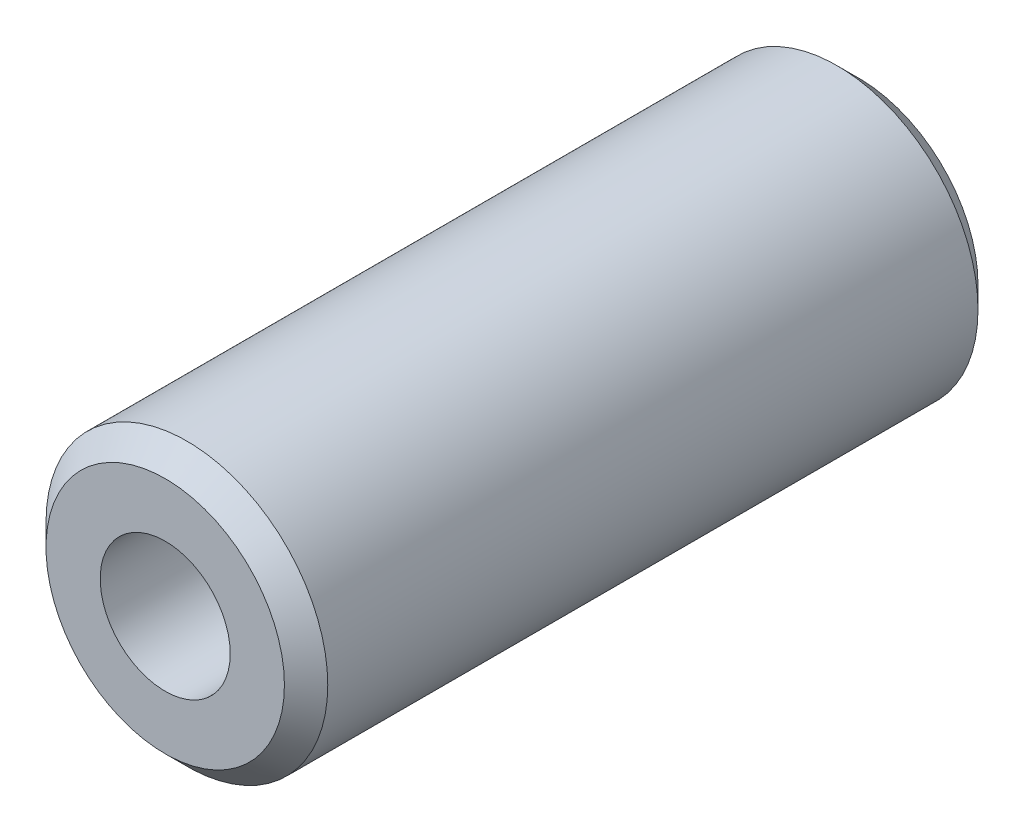
from build123d import *

# Parameters (mm, degrees)
SKETCH1_R           = 6.5
SKETCH1_R_2         = 3
BOSS_EXTRUDE1_DEPTH = 32
CHAMFER1_SIZE       = 1


with BuildPart() as part:
    # Sketch1 → Boss-Extrude1 (new body)
    with BuildSketch(Plane(origin=(0, 0, 0), x_dir=(0, 1, 0), z_dir=(0, 0, 1))):
        Circle(SKETCH1_R)
        Circle(SKETCH1_R_2, mode=Mode.SUBTRACT)
    extrude(amount=BOSS_EXTRUDE1_DEPTH)

    # Chamfer1
    chamfer1_edges = [part.edges().sort_by_distance(p)[0] for p in [
        (0, -6.5, 0),
        (0, -6.5, 32),
    ]]
    chamfer(chamfer1_edges, length=CHAMFER1_SIZE)


solid = part.part
